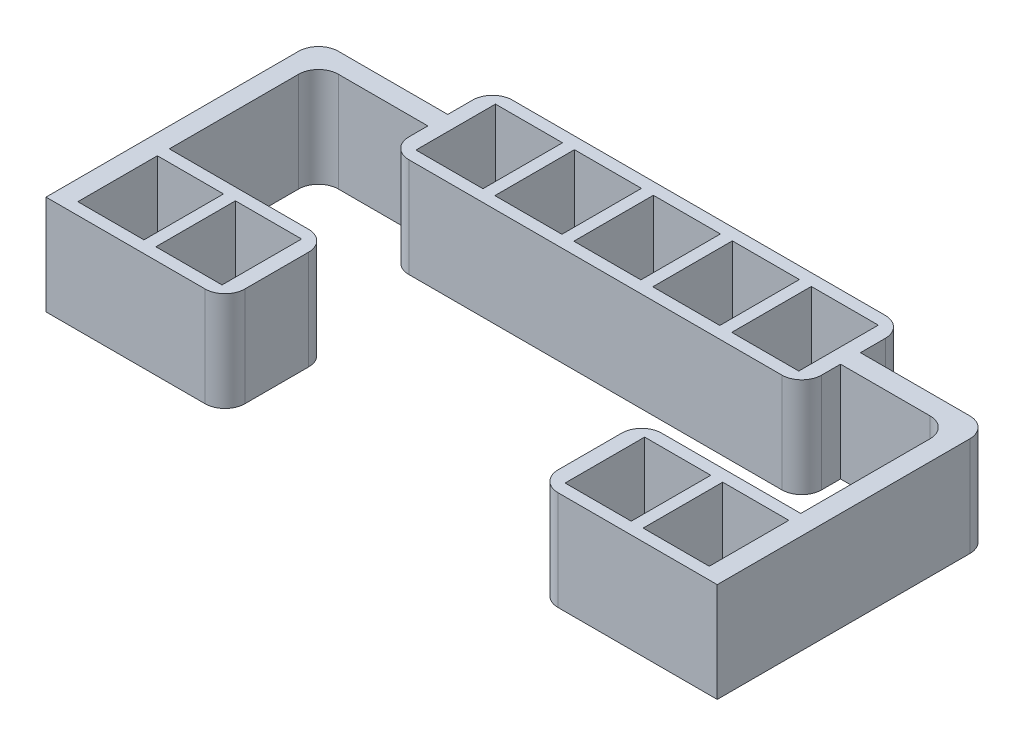
from build123d import *

# Parameters (mm, degrees)
ESBO_O1_W                = 6.74
ESBO_O1_H                = 8
ESBO_O1_W_2              = 6.65
RESSALTO_EXTRUS_O1_DEPTH = 10


with BuildPart() as part:
    # Esboço1 → Ressalto-extrusão1 (new body)
    # profile 1 of 3: a face of its own
    with BuildSketch(Plane(origin=(0, 0, 0), x_dir=(1, 0, 0), z_dir=(0, 1, 0))):
        with BuildLine():
            Line((18.75, 5.2), (-18.75, 5.2))
            ThreePointArc((-18.75, 5.2), (-20.164213562, 4.614213562), (-20.75, 3.2))
            Line((-20.75, 3.2), (-20.75, 0.7))
            Line((-20.75, 0.7), (-20.75, -1.3))
            Line((-20.75, -1.3), (-20.75, -3.2))
            ThreePointArc((-20.75, -3.2), (-20.164213562, -4.614213562), (-18.75, -5.2))
            Line((-18.75, -5.2), (18.75, -5.2))
            ThreePointArc((18.75, -5.2), (20.164213562, -4.614213562), (20.75, -3.2))
            Line((20.75, -3.2), (20.75, -1.3))
            Line((20.75, -1.3), (20.75, 0.7))
            Line((20.75, 0.7), (20.75, 3.2))
            ThreePointArc((20.75, 3.2), (20.164213562, 4.614213562), (18.75, 5.2))
        make_face()
        with Locations((-15.88, 0)):
            Rectangle(ESBO_O1_W, ESBO_O1_H, mode=Mode.SUBTRACT)
        with Locations((-7.94, 0)):
            Rectangle(ESBO_O1_W, ESBO_O1_H, mode=Mode.SUBTRACT)
        Rectangle(ESBO_O1_W, ESBO_O1_H, mode=Mode.SUBTRACT)
        with Locations((7.94, 0)):
            Rectangle(ESBO_O1_W, ESBO_O1_H, mode=Mode.SUBTRACT)
        with Locations((15.88, 0)):
            Rectangle(ESBO_O1_W, ESBO_O1_H, mode=Mode.SUBTRACT)
    # profile 2 of 3: a face of its own
    with BuildSketch(Plane(origin=(0, 0, 0), x_dir=(1, 0, 0), z_dir=(0, 1, 0))):
        with BuildLine():
            Line((-20.75, -1.3), (-20.75, 0.7))
            Line((-20.75, 0.7), (-31.75, 0.7))
            ThreePointArc((-31.75, 0.7), (-33.164213562, 0.114213562), (-33.75, -1.3))
            Line((-33.75, -1.3), (-33.75, -14.642724204))
            Line((-33.75, -14.642724204), (-33.75, -16))
            Line((-33.75, -16), (-33.75, -16.3))
            Line((-33.75, -16.3), (-33.75, -17.5))
            Line((-33.75, -17.5), (-33.75, -25.5))
            Line((-33.75, -25.5), (-33.75, -26.7))
            Line((-33.75, -26.7), (-17.75, -26.7))
            ThreePointArc((-17.75, -26.7), (-16.335786438, -26.114213562), (-15.75, -24.7))
            Line((-15.75, -24.7), (-15.75, -18.3))
            ThreePointArc((-15.75, -18.3), (-16.335786438, -16.885786438), (-17.75, -16.3))
            Line((-17.75, -16.3), (-31.75, -16.3))
            Line((-31.75, -16.3), (-31.75, -16))
            Line((-31.75, -16), (-31.75, -3.3))
            ThreePointArc((-31.75, -3.3), (-31.164213562, -1.885786438), (-29.75, -1.3))
            Line((-29.75, -1.3), (-20.75, -1.3))
        make_face()
        with Locations((-28.425, -21.5)):
            Rectangle(ESBO_O1_W_2, ESBO_O1_H, mode=Mode.SUBTRACT)
        with Locations((-20.575, -21.5)):
            Rectangle(ESBO_O1_W_2, ESBO_O1_H, mode=Mode.SUBTRACT)
    # profile 3 of 3: a face of its own
    with BuildSketch(Plane(origin=(0, 0, 0), x_dir=(1, 0, 0), z_dir=(0, 1, 0))):
        with BuildLine():
            Line((31.75, 0.7), (20.75, 0.7))
            Line((20.75, 0.7), (20.75, -1.3))
            Line((20.75, -1.3), (29.75, -1.3))
            ThreePointArc((29.75, -1.3), (31.164213562, -1.885786438), (31.75, -3.3))
            Line((31.75, -3.3), (31.75, -16))
            Line((31.75, -16), (31.75, -16.3))
            Line((31.75, -16.3), (17.75, -16.3))
            ThreePointArc((17.75, -16.3), (16.335786438, -16.885786438), (15.75, -18.3))
            Line((15.75, -18.3), (15.75, -24.7))
            ThreePointArc((15.75, -24.7), (16.335786438, -26.114213562), (17.75, -26.7))
            Line((17.75, -26.7), (33.75, -26.7))
            Line((33.75, -26.7), (33.75, -25.5))
            Line((33.75, -25.5), (33.75, -17.5))
            Line((33.75, -17.5), (33.75, -16.3))
            Line((33.75, -16.3), (33.75, -16))
            Line((33.75, -16), (33.75, -14.642724204))
            Line((33.75, -14.642724204), (33.75, -1.3))
            ThreePointArc((33.75, -1.3), (33.164213562, 0.114213562), (31.75, 0.7))
        make_face()
        with Locations((20.575, -21.5)):
            Rectangle(ESBO_O1_W_2, ESBO_O1_H, mode=Mode.SUBTRACT)
        with Locations((28.425, -21.5)):
            Rectangle(ESBO_O1_W_2, ESBO_O1_H, mode=Mode.SUBTRACT)
    extrude(amount=RESSALTO_EXTRUS_O1_DEPTH)


solid = part.part
